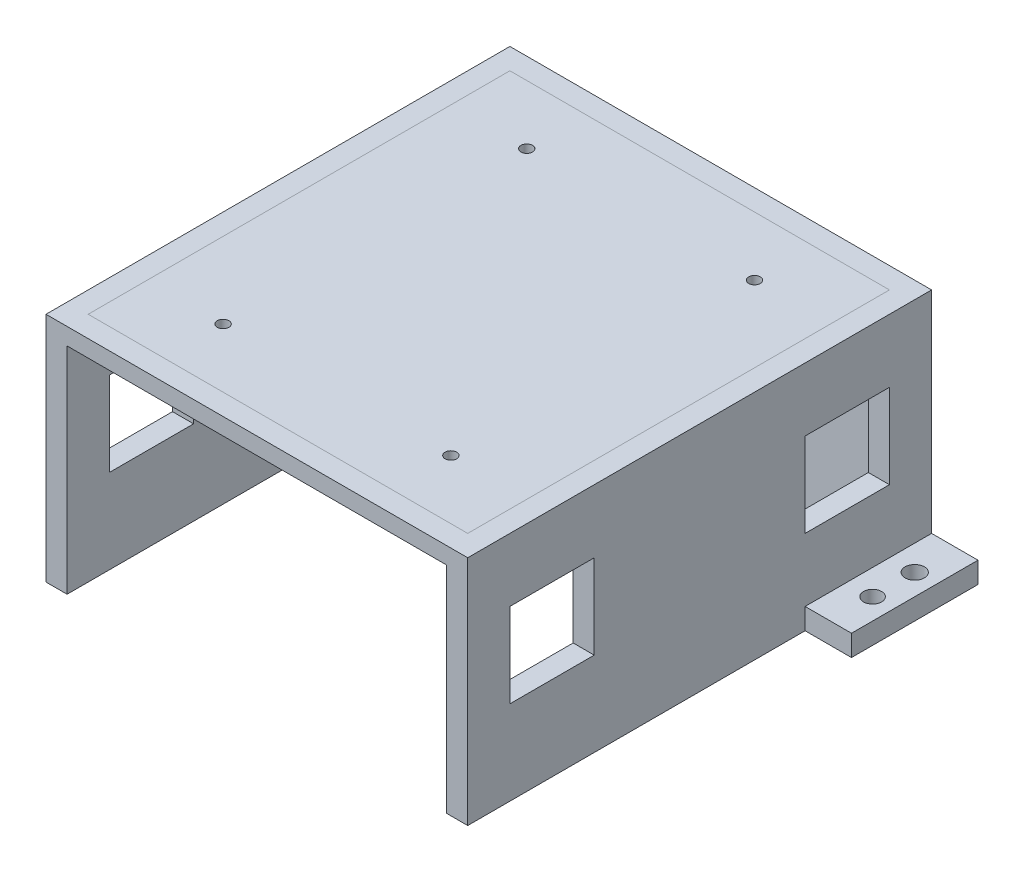
from build123d import *

# Parameters (mm, degrees)
SKETCH1_W           = 90
SKETCH1_H           = 100
BOSS_EXTRUDE1_DEPTH = 4
SKETCH2_R           = 1.375
CUT_EXTRUDE1_DEPTH  = 4
SKETCH3_W           = 100
SKETCH3_H           = 110
SKETCH3_W_2         = 90
SKETCH3_H_2         = 100
BOSS_EXTRUDE2_DEPTH = 55
SKETCH4_W           = 11
SKETCH4_H           = 30
BOSS_EXTRUDE3_DEPTH = 5
SKETCH5_R           = 2.286590725
SKETCH5_R_2         = 2.149881735
CUT_EXTRUDE2_DEPTH  = 99.848368727
SKETCH6_W           = 90
SKETCH6_H           = 51
CUT_EXTRUDE3_DEPTH  = 10
SKETCH7_W           = 20
SKETCH7_H           = 20
CUT_EXTRUDE4_DEPTH  = 134.966413701
SKETCH8_W           = 40
SKETCH8_H           = 15
CUT_EXTRUDE5_DEPTH  = 136.727668513


with BuildPart() as part:
    # Sketch1 → Boss-Extrude1 (new body)
    with BuildSketch(Plane(origin=(0, 0, 0), x_dir=(1, 0, 0), z_dir=(0, 1, 0))):
        Rectangle(SKETCH1_W, SKETCH1_H)
    extrude(amount=BOSS_EXTRUDE1_DEPTH)

    # Sketch2 → Cut-Extrude1 (cut)
    with BuildSketch(Plane(origin=(0, 4, 0), x_dir=(1, 0, 0), z_dir=(0, 1, 0))):
        with Locations(Location((-27, 36, 0), (0, 0, 270))):
            Circle(SKETCH2_R)
        with Locations(Location((27, 36, 0), (0, 0, 90))):
            Circle(SKETCH2_R)
        with Locations(Location((27, -36, 0), (0, 0, 270))):
            Circle(SKETCH2_R)
        with Locations(Location((-27, -36, 0), (0, 0, 90))):
            Circle(SKETCH2_R)
    extrude(amount=-CUT_EXTRUDE1_DEPTH, mode=Mode.SUBTRACT)


with BuildPart() as body_2:
    # Sketch3 → Boss-Extrude2 (new body)
    with BuildSketch(Plane(origin=(0, 4, 0), x_dir=(1, 0, 0), z_dir=(0, 1, 0))):
        Rectangle(SKETCH3_W, SKETCH3_H)
        Rectangle(SKETCH3_W_2, SKETCH3_H_2, mode=Mode.SUBTRACT)
    extrude(amount=-BOSS_EXTRUDE2_DEPTH)

    # Sketch4 → Boss-Extrude3 (add)
    with BuildSketch(Plane.XZ.offset(51)):
        with Locations((-55.5, -40)):
            Rectangle(SKETCH4_W, SKETCH4_H)
    boss_extrude3 = extrude(amount=-BOSS_EXTRUDE3_DEPTH)

    # Mirror1: Boss-Extrude3 across plane
    add(boss_extrude3.mirror(Plane(origin=(0, 0, 0), x_dir=(0, 0, 1), z_dir=(1, 0, 0))))

    # Sketch5 → Cut-Extrude2 (cut, through all)
    with BuildSketch(Plane.XZ.offset(51)):
        with Locations(Location((-56, -45, 0), (0, 0, 270))):
            Circle(SKETCH5_R)
        with Locations(Location((-56, -35, 0), (0, 0, 270))):
            Circle(SKETCH5_R_2)
        with Locations(Location((56, -45, 0), (0, 0, 270))):
            Circle(SKETCH5_R)
        with Locations(Location((56, -35, 0), (0, 0, 270))):
            Circle(SKETCH5_R_2)
    extrude(amount=-CUT_EXTRUDE2_DEPTH, mode=Mode.SUBTRACT)

    # Sketch6 → Cut-Extrude3 (cut)
    with BuildSketch(Plane.XY.offset(55)):
        with Locations((0, -25.5)):
            Rectangle(SKETCH6_W, SKETCH6_H)
    extrude(amount=-CUT_EXTRUDE3_DEPTH, mode=Mode.SUBTRACT)

    # Sketch7 → Cut-Extrude4 (cut, through all)
    with BuildSketch(Plane.ZY.offset(50)):
        with Locations((-35, -21)):
            Rectangle(SKETCH7_W, SKETCH7_H)
        with Locations((35, -21)):
            Rectangle(SKETCH7_W, SKETCH7_H)
    extrude(amount=-CUT_EXTRUDE4_DEPTH, mode=Mode.SUBTRACT)

    # Sketch8 → Cut-Extrude5 (cut, through all)
    with BuildSketch(Plane(origin=(0, 0, -55), x_dir=(-1, 0, 0), z_dir=(0, 0, -1))):
        with Locations((0, -31)):
            Rectangle(SKETCH8_W, SKETCH8_H)
    extrude(amount=-CUT_EXTRUDE5_DEPTH, mode=Mode.SUBTRACT)


solid = Compound([part.part, body_2.part])
